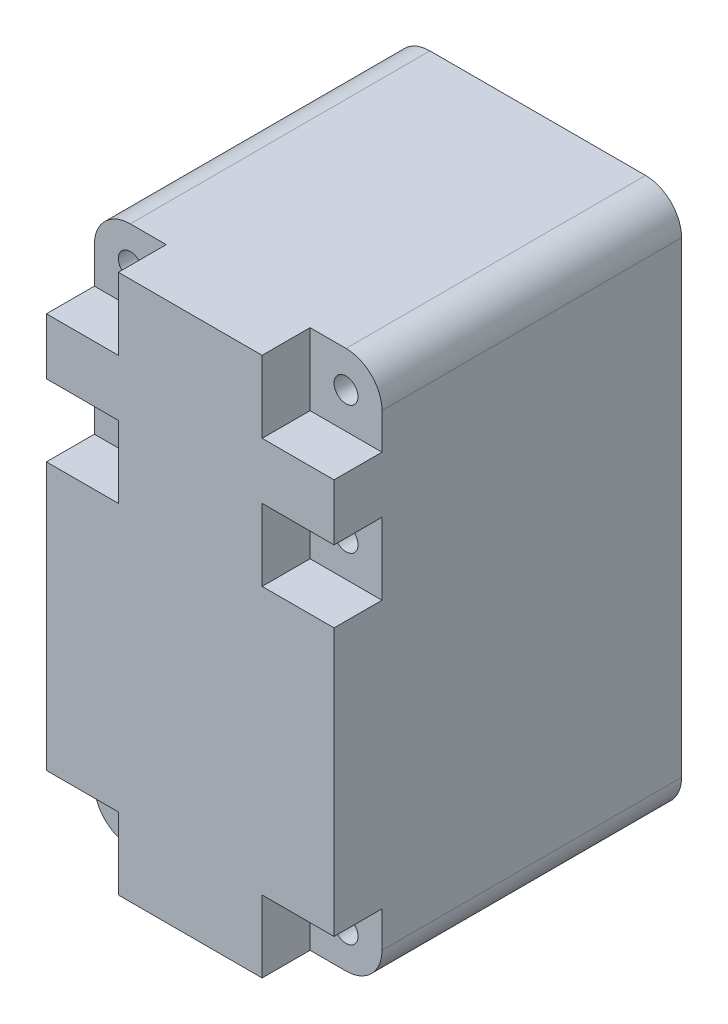
from build123d import *

# Parameters (mm, degrees)
BOSS_EXTRU_1_DEPTH      = 14.5
ESQUISSE2_R             = 1
ENL_V_MAT_EXTRU_1_DEPTH = 9
ESQUISSE4_W             = 6
ESQUISSE4_H             = 6
ENL_V_MAT_EXTRU_2_DEPTH = 4


with BuildPart() as part:
    # Esquisse1 → Boss.-Extru.1 (new, symmetric)
    with BuildSketch(Plane.XY):
        with BuildLine():
            Line((-9, -22.5), (9, -22.5))
            ThreePointArc((9, -22.5), (11.121320344, -21.621320344), (12, -19.5))
            Line((12, -19.5), (12, 19.5))
            ThreePointArc((12, 19.5), (11.121320344, 21.621320344), (9, 22.5))
            Line((9, 22.5), (-9, 22.5))
            ThreePointArc((-9, 22.5), (-11.121320344, 21.621320344), (-12, 19.5))
            Line((-12, 19.5), (-12, -19.5))
            ThreePointArc((-12, -19.5), (-11.121320344, -21.621320344), (-9, -22.5))
        make_face()
    extrude(amount=BOSS_EXTRU_1_DEPTH, both=True)

    # Esquisse2 → Enlèv. mat.-Extru.1 (cut)
    with BuildSketch(Plane.XY.offset(14.5)):
        with Locations((9, 19.5)):
            Circle(ESQUISSE2_R)
        with Locations((-9, 19.5)):
            Circle(ESQUISSE2_R)
        with Locations((-9, 8.8)):
            Circle(ESQUISSE2_R)
        with Locations((9, 8.8)):
            Circle(ESQUISSE2_R)
        with Locations((-9, -19.5)):
            Circle(ESQUISSE2_R)
        with Locations((9, -19.5)):
            Circle(ESQUISSE2_R)
    extrude(amount=-ENL_V_MAT_EXTRU_1_DEPTH, mode=Mode.SUBTRACT)

    # Esquisse4 → Enlèv. mat.-Extru.2 (cut)
    with BuildSketch(Plane.XY.offset(14.5)):
        with Locations((-9, 19.5)):
            Rectangle(ESQUISSE4_W, ESQUISSE4_H)
        with Locations((9, 19.5)):
            Rectangle(ESQUISSE4_W, ESQUISSE4_H)
        with Locations((9, 8.8)):
            Rectangle(ESQUISSE4_W, ESQUISSE4_H)
        with Locations((-9, 8.8)):
            Rectangle(ESQUISSE4_W, ESQUISSE4_H)
        with Locations((-9, -19.5)):
            Rectangle(ESQUISSE4_W, ESQUISSE4_H)
        with Locations((9, -19.5)):
            Rectangle(ESQUISSE4_W, ESQUISSE4_H)
    extrude(amount=-ENL_V_MAT_EXTRU_2_DEPTH, mode=Mode.SUBTRACT)


solid = part.part
